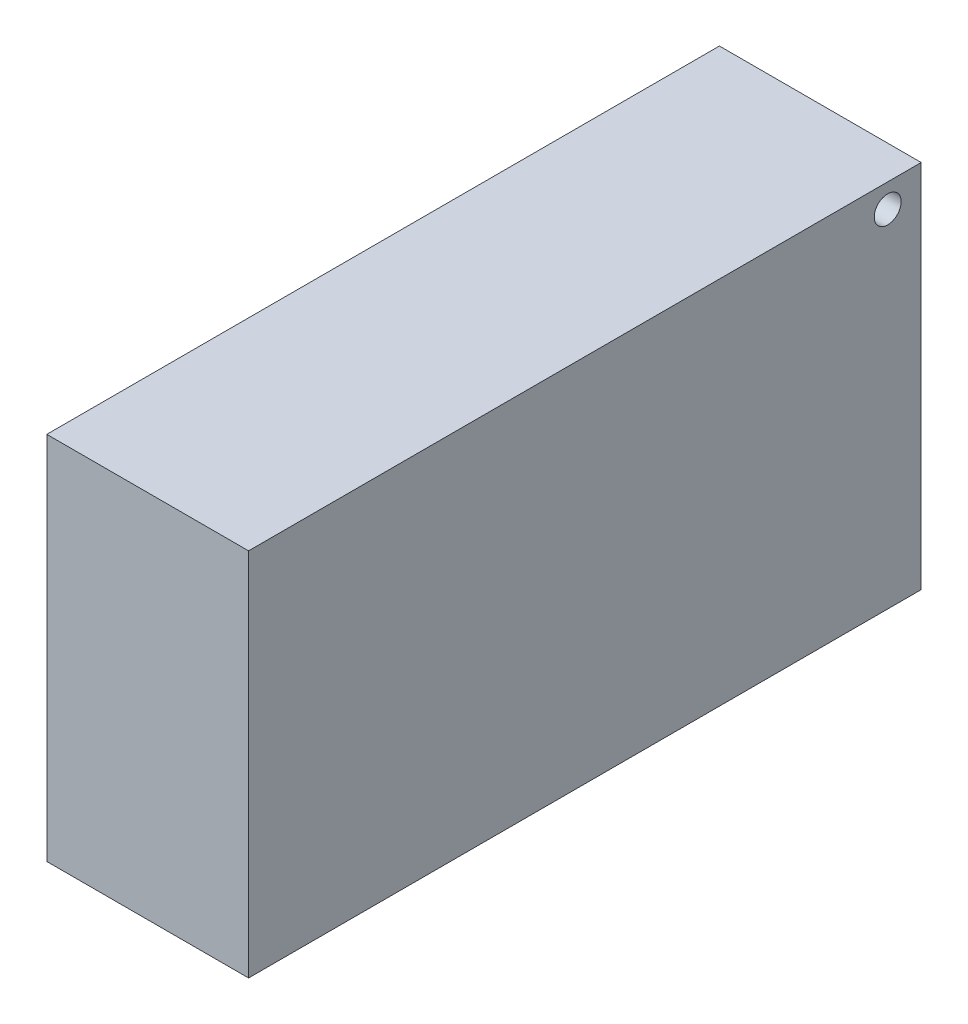
from build123d import *

# Parameters (mm, degrees)
SKETCH_1_W          = 200
SKETCH_1_H          = 110
EXTRUDE_1_DEPTH     = 60
SKETCH_3_R          = 4
CUT_EXTRUDE_2_DEPTH = 20


with BuildPart() as part:
    # Эскиз1 → Бобышка-Вытянуть1 (new body)
    with BuildSketch(Plane(origin=(0, 0, 0), x_dir=(0, 0, -1), z_dir=(1, 0, 0))):
        with Locations((111.99379123, 53.09072323)):
            Rectangle(SKETCH_1_W, SKETCH_1_H)
    extrude(amount=EXTRUDE_1_DEPTH)

    # Эскиз3 → Вырез-Вытянуть2 (cut)
    with BuildSketch(Plane(origin=(60, 0, 0), x_dir=(0, 0, -1), z_dir=(1, 0, 0))):
        with Locations((202.033930041, 101.016084536)):
            Circle(SKETCH_3_R)
    extrude(amount=-CUT_EXTRUDE_2_DEPTH, mode=Mode.SUBTRACT)


solid = part.part
